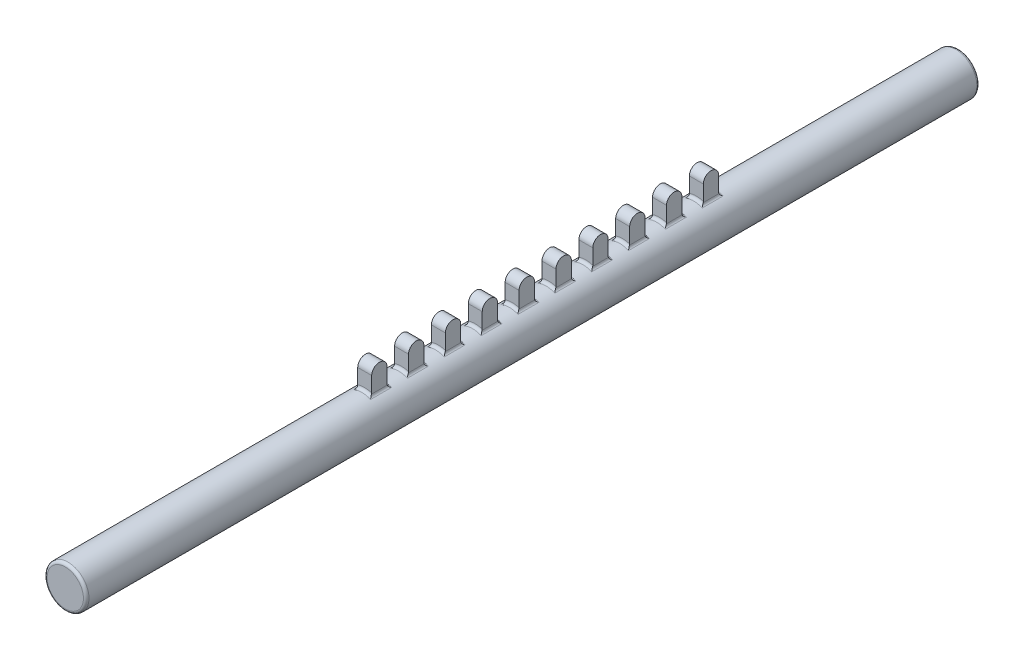
from build123d import *

# Parameters (mm, degrees)
BOSS_EXTRUDE1_DEPTH      = 200
BOSS_EXTRUDE1_DEPTH_BACK = 120
SKETCH1_R                = 7.5
BOSS_EXTRUDE2_DEPTH      = 2.5
LPATTERN1_COUNT          = 10
LPATTERN1_PITCH          = 13.2
FILLET1_R                = 1


with BuildPart() as part:
    # Sketch1 → Boss-Extrude1 (new, two sides: drawn at the far end of the back side and taken through both)
    with BuildSketch(Plane.XY.offset(-BOSS_EXTRUDE1_DEPTH_BACK)):
        Circle(SKETCH1_R)
    extrude(amount=BOSS_EXTRUDE1_DEPTH + BOSS_EXTRUDE1_DEPTH_BACK)

    # Sketch3 → Boss-Extrude2 (add, symmetric)
    with BuildSketch(Plane(origin=(0, 0, 0), x_dir=(0, 0, -1), z_dir=(1, 0, 0))):
        with BuildLine():
            Line((-92.75, 0), (-92.75, 13.5))
            ThreePointArc((-92.75, 13.5), (-90, 16.25), (-87.25, 13.5))
            Line((-87.25, 13.5), (-87.25, 0))
            Line((-87.25, 0), (-92.75, 0))
        make_face()
    boss_extrude2 = extrude(amount=BOSS_EXTRUDE2_DEPTH, both=True)

    # LPattern1: Boss-Extrude2 ×10
    with Locations(*[(0, 0, -i * LPATTERN1_PITCH) for i in range(1, LPATTERN1_COUNT)]):
        add(boss_extrude2)

    # Fillet1
    fillet1_edges = [part.edges().sort_by_distance(p)[0] for p in [
        (-2.5, 7.071067812, 10.8),
        (0, 7.5, 13.55),
        (0, 7.5, 8.05),
        (2.5, 7.071067812, 10.8),
        (-2.5, 7.071067812, -2.4),
        (0, 7.5, 0.35),
        (0, 7.5, -5.15),
        (2.5, 7.071067812, -2.4),
        (-2.5, 7.071067812, -15.6),
        (0, 7.5, -12.85),
        (0, 7.5, -18.35),
        (2.5, 7.071067812, -15.6),
        (-2.5, 7.071067812, -28.8),
        (0, 7.5, -26.05),
        (0, 7.5, -31.55),
        (2.5, 7.071067812, -28.8),
        (-2.5, 7.071067812, 76.8),
        (0, 7.5, 79.55),
        (0, 7.5, 74.05),
        (2.5, 7.071067812, 76.8),
        (-7.5, 0, -120),
        (-2.5, 7.071067812, 63.6),
        (0, 7.5, 66.35),
        (0, 7.5, 60.85),
        (2.5, 7.071067812, 63.6),
        (-7.5, 0, 200),
        (-2.5, 7.071067812, 50.4),
        (0, 7.5, 53.15),
        (0, 7.5, 47.65),
        (2.5, 7.071067812, 50.4),
        (-2.5, 7.071067812, 37.2),
        (0, 7.5, 39.95),
        (0, 7.5, 34.45),
        (2.5, 7.071067812, 37.2),
        (-2.5, 7.071067812, 90),
        (0, 7.5, 92.75),
        (0, 7.5, 87.25),
        (-2.5, 7.071067812, 24),
        (0, 7.5, 26.75),
        (0, 7.5, 21.25),
        (2.5, 7.071067812, 24),
        (2.5, 7.071067812, 90),
    ]]
    fillet(fillet1_edges, radius=FILLET1_R)


solid = part.part
